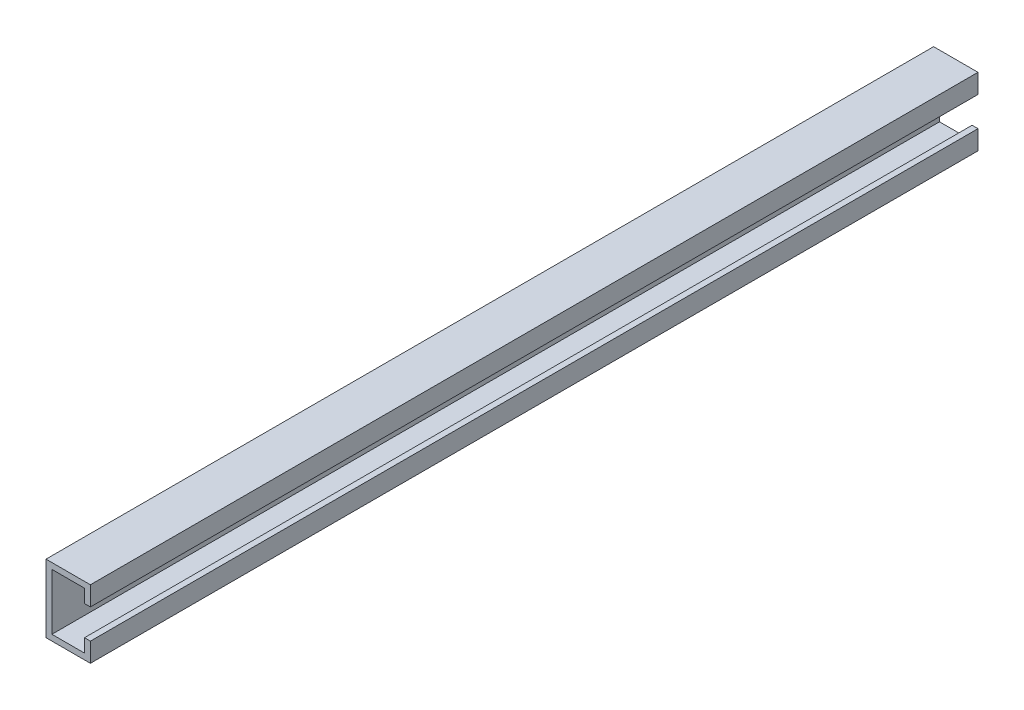
from build123d import *

# Parameters (mm, degrees)
EXTRUDE_1_DEPTH = 300


with BuildPart() as part:
    # 草图1 → 凸台-拉伸1 (new body)
    with BuildSketch(Plane.XY):
        Polygon((0, 0), (15, 0), (15, -6.5), (13, -6.5), (13, -2), (2, -2), (2, -21), (13, -21), (13, -16.5), (15, -16.5), (15, -23), (0, -23), align=None)
    extrude(amount=EXTRUDE_1_DEPTH)


solid = part.part
